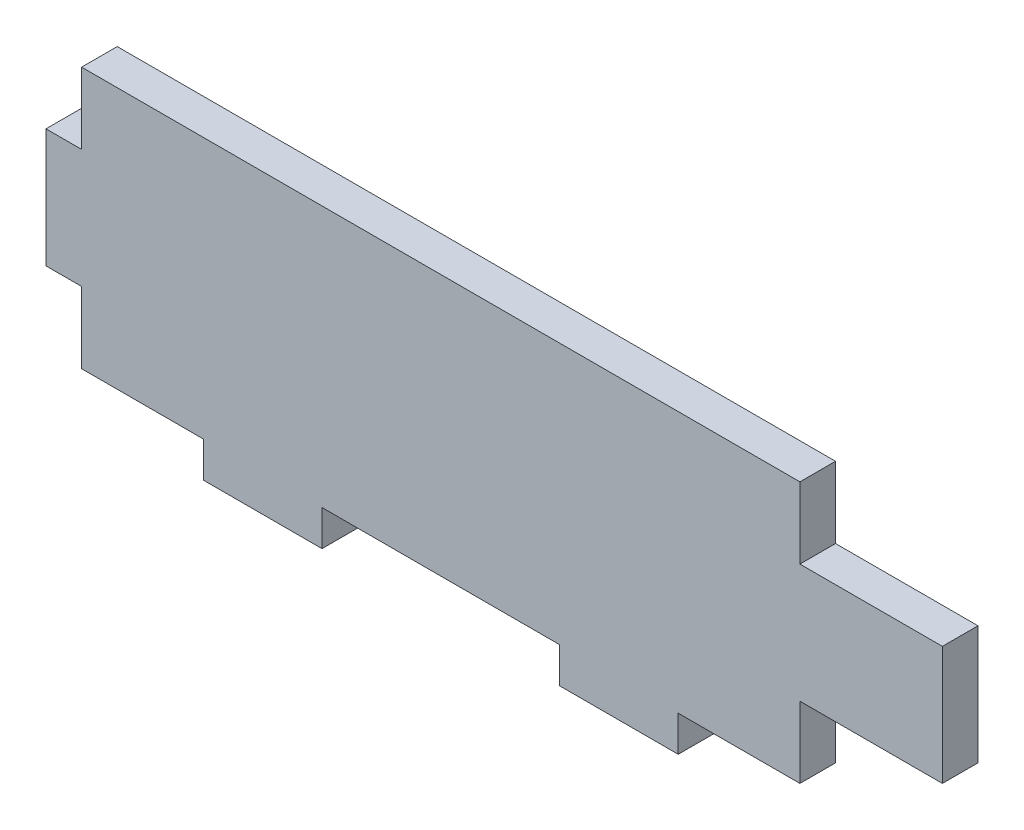
from build123d import *

# Parameters (mm, degrees)
BOSS_EXTRUDE1_DEPTH = 3
SKETCH2_W           = 3
SKETCH2_H           = 10
CUT_EXTRUDE1_DEPTH  = 48.461168338


with BuildPart() as part:
    # Sketch1 → Boss-Extrude1 (new body)
    with BuildSketch(Plane.XY):
        Polygon((-30.25, 11), (30.25, 11), (30.25, 5), (45.25, 5), (45.25, -5), (30.25, -5), (30.25, -11), (20, -11), (20, -14), (10, -14), (10, -11), (-10, -11), (-10, -14), (-20, -14), (-20, -11), (-30.25, -11), (-30.25, -5), (-33.25, -5), (-33.25, 5), (-30.25, 5), align=None)
    extrude(amount=BOSS_EXTRUDE1_DEPTH)

    # Sketch2 → Cut-Extrude1 (cut, through all)
    with BuildSketch(Plane.XY.offset(3)):
        with Locations((43.75, 0)):
            Rectangle(SKETCH2_W, SKETCH2_H)
    extrude(amount=-CUT_EXTRUDE1_DEPTH, mode=Mode.SUBTRACT)


solid = part.part
